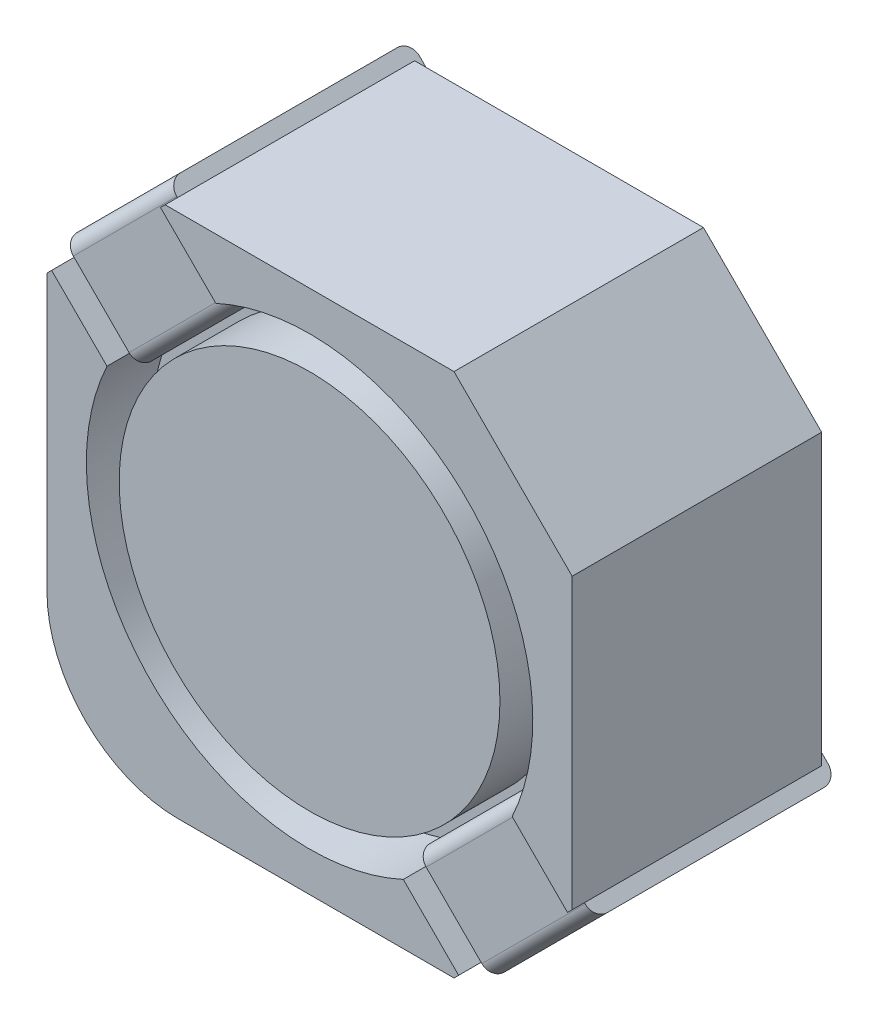
from build123d import *

# Parameters (mm, degrees)
EXTRUDE_START        = 0.1
EXTRUDE_1_DEPTH      = 1.9
SKETCH_6_R           = 1.7
CUT_EXTRUDE_5_DEPTH  = 0.3
SKETCH_8_R           = 1.45
EXTRUDE_9_DEPTH      = 0.25
CUT_EXTRUDE_START    = 1.5
SKETCH_6_3_R         = 1.7
CUT_EXTRUDE_12_DEPTH = 0.6
CUT_EXTRUDE_START_2  = 0.05
SKETCH_12_W          = 1.35
SKETCH_12_H          = 0.8
CUT_EXTRUDE_15_DEPTH = 1.172792206
EXTRUDE_START_2      = 1.3
SKETCH_8_3_R         = 1.45
EXTRUDE_16_DEPTH     = 0.7
EXTRUDE_START_3      = 0.08
EXTRUDE_17_DEPTH     = 1.112792206


with BuildPart() as part:
    # Эскиз2 → Вытянуть1 (new body)
    with BuildSketch(Plane.XY.offset(EXTRUDE_START)):
        with BuildLine():
            Line((-1.1, 2), (1.1, 2))
            Line((1.1, 2), (2, 1.1))
            Line((2, 1.1), (2, -1.1))
            Line((2, -1.1), (1.1, -2))
            Line((1.1, -2), (-1, -2))
            ThreePointArc((-1, -2), (-1.707106781, -1.707106781), (-2, -1))
            Line((-2, -1), (-2, 1.1))
            Line((-2, 1.1), (-1.1, 2))
        make_face()
    extrude(amount=EXTRUDE_1_DEPTH)

    # Эскиз6 → Вытянуть5 (cut)
    with BuildSketch(Plane.XY):
        Circle(SKETCH_6_R)
    extrude(amount=CUT_EXTRUDE_5_DEPTH, mode=Mode.SUBTRACT)

    # Эскиз8 → Вытянуть9 (add)
    with BuildSketch(Plane.XY.offset(EXTRUDE_START)):
        Circle(SKETCH_8_R)
    extrude(amount=EXTRUDE_9_DEPTH)

    # Эскиз6<3> → Вытянуть12 (cut)
    with BuildSketch(Plane.XY.offset(CUT_EXTRUDE_START)):
        Circle(SKETCH_6_3_R)
    extrude(amount=CUT_EXTRUDE_12_DEPTH, mode=Mode.SUBTRACT)

    # Эскиз12 → Вытянуть15 (cut)
    with BuildSketch(Plane(origin=(-0.45, -0.45, 0), x_dir=(0, 0, -1), z_dir=(0.7071067811865499, 0.7071067811865452, 0)).offset(CUT_EXTRUDE_START_2)):
        with Locations((-2.375, 1.9)):
            Rectangle(SKETCH_12_W, SKETCH_12_H)
        with Locations((-2.375, -1.9)):
            Rectangle(SKETCH_12_W, SKETCH_12_H)
    extrude(amount=CUT_EXTRUDE_15_DEPTH, mode=Mode.SUBTRACT)

    # Эскиз8<3> → Вытянуть16 (add)
    with BuildSketch(Plane.XY.offset(EXTRUDE_START_2)):
        Circle(SKETCH_8_3_R)
    extrude(amount=EXTRUDE_16_DEPTH)

    # Эскиз10 → Вытянуть17 (add)
    with BuildSketch(Plane(origin=(-0.45, -0.45, 0), x_dir=(0, 0, -1), z_dir=(0.7071067811865499, 0.7071067811865452, 0)).offset(EXTRUDE_START_3)):
        with BuildLine():
            Line((0, 1.6), (0, 2.2))
            ThreePointArc((0, 2.2), (-0.029289322, 2.270710678), (-0.1, 2.3))
            Line((-0.1, 2.3), (-1.75, 2.3))
            ThreePointArc((-1.75, 2.3), (-1.820710678, 2.270710678), (-1.85, 2.2))
            Line((-1.85, 2.2), (-1.85, 1.6))
            ThreePointArc((-1.85, 1.6), (-1.820710678, 1.529289322), (-1.75, 1.5))
            Line((-1.75, 1.5), (-0.1, 1.5))
            ThreePointArc((-0.1, 1.5), (-0.029289322, 1.529289322), (0, 1.6))
        make_face()
        with BuildLine():
            Line((-1.75, -1.5), (-0.1, -1.5))
            ThreePointArc((-0.1, -1.5), (-0.029289322, -1.529289322), (0, -1.6))
            Line((0, -1.6), (0, -2.2))
            ThreePointArc((0, -2.2), (-0.029289322, -2.270710678), (-0.1, -2.3))
            Line((-0.1, -2.3), (-1.75, -2.3))
            ThreePointArc((-1.75, -2.3), (-1.820710678, -2.270710678), (-1.85, -2.2))
            Line((-1.85, -2.2), (-1.85, -1.6))
            ThreePointArc((-1.85, -1.6), (-1.820710678, -1.529289322), (-1.75, -1.5))
        make_face()
    extrude(amount=EXTRUDE_17_DEPTH)


solid = part.part
